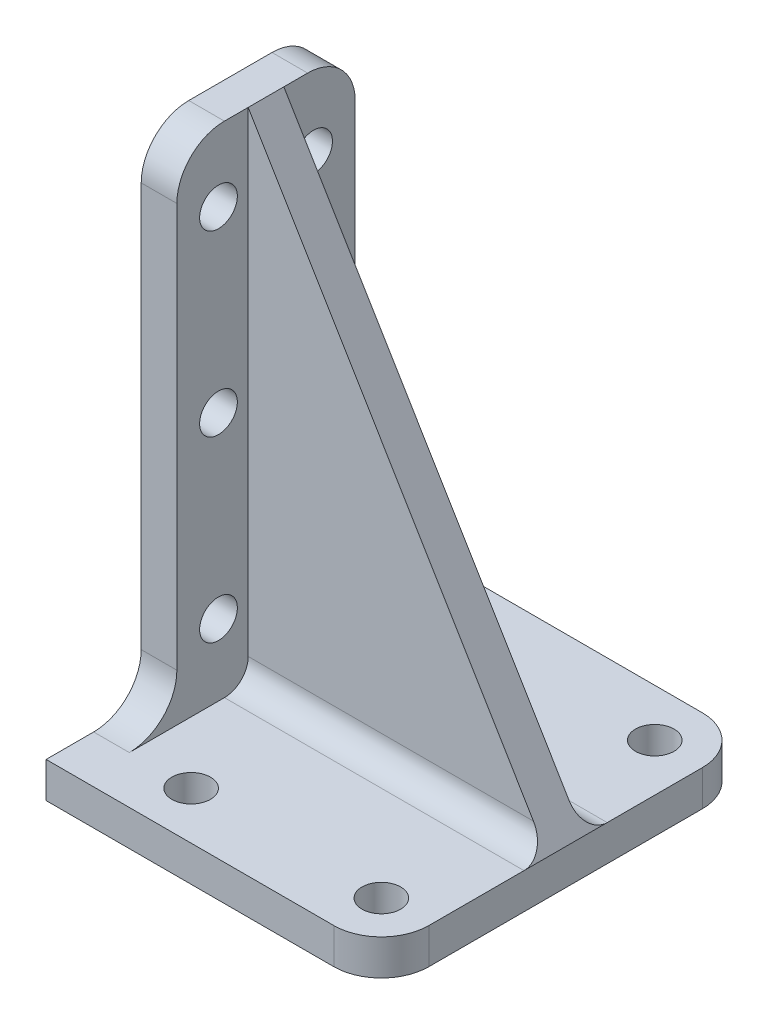
from build123d import *

# Parameters (mm, degrees)
RESSALTO_EXTRUS_O1_DEPTH = 30
ESBO_O2_W                = 12
ESBO_O2_H                = 94
CORTE_EXTRUS_O1_DEPTH    = 118.541482039
ESBO_O3_W                = 30
ESBO_O3_H                = 10
CORTE_EXTRUS_O2_DEPTH    = 118.541482039
ESBO_O4_W                = 3.6
ESBO_O4_H                = 30
CORTE_EXTRUS_O3_DEPTH    = 108.498837203
ESBO_O5_W                = 56.4
ESBO_O5_H                = 6
RESSALTO_EXTRUS_O2_DEPTH = 16
ESBO_O6_W                = 56.4
ESBO_O6_H                = 6
RESSALTO_EXTRUS_O3_DEPTH = 16
FILETE1_R                = 8
FILETE2_R                = 8
FILETE3_R                = 8
FILETE4_R                = 4
ESBO_O7_R                = 3.175
CORTE_EXTRUS_O4_DEPTH    = 113.943171551
ESBO_O8_R                = 3.25
CORTE_EXTRUS_O5_DEPTH    = 112.143870726


with BuildPart() as part:
    # Esboço1 → Ressalto-extrusão1 (new body)
    with BuildSketch(Plane.XY):
        Polygon((0, 0), (0, 100), (60, 0), align=None)
    extrude(amount=RESSALTO_EXTRUS_O1_DEPTH)

    # Esboço2 → Corte-extrusão1 (cut, through all)
    with BuildSketch(Plane.ZY.offset(-6)):
        with Locations((24, 53)):
            Rectangle(ESBO_O2_W, ESBO_O2_H)
        with Locations((6, 53)):
            Rectangle(ESBO_O2_W, ESBO_O2_H)
    extrude(amount=-CORTE_EXTRUS_O1_DEPTH, mode=Mode.SUBTRACT)

    # Esboço3 → Corte-extrusão2 (cut, through all)
    with BuildSketch(Plane(origin=(6, 0, 0), x_dir=(0, 0, -1), z_dir=(1, 0, 0))):
        with Locations((-15, 95)):
            Rectangle(ESBO_O3_W, ESBO_O3_H)
    extrude(amount=-CORTE_EXTRUS_O2_DEPTH, mode=Mode.SUBTRACT)

    # Esboço4 → Corte-extrusão3 (cut, through all)
    with BuildSketch(Plane(origin=(0, 6, 0), x_dir=(1, 0, 0), z_dir=(0, 1, 0))):
        with Locations((58.2, -15)):
            Rectangle(ESBO_O4_W, ESBO_O4_H)
    extrude(amount=-CORTE_EXTRUS_O3_DEPTH, mode=Mode.SUBTRACT)

    # Esboço5 → Ressalto-extrusão2 (add)
    with BuildSketch(Plane.XY.offset(30)):
        with Locations((28.2, 3)):
            Rectangle(ESBO_O5_W, ESBO_O5_H)
    extrude(amount=RESSALTO_EXTRUS_O2_DEPTH)

    # Esboço6 → Ressalto-extrusão3 (add)
    with BuildSketch(Plane(origin=(0, 0, 0), x_dir=(-1, 0, 0), z_dir=(0, 0, -1))):
        with Locations((-28.2, 3)):
            Rectangle(ESBO_O6_W, ESBO_O6_H)
    extrude(amount=RESSALTO_EXTRUS_O3_DEPTH)

    # Filete1
    filete1_edges = [part.edges().sort_by_distance(p)[0] for p in [
        (3, 6, 0),
        (3, 6, 30),
    ]]
    fillet(filete1_edges, radius=FILETE1_R)

    # Filete2
    filete2_edges = [part.edges().sort_by_distance(p)[0] for p in [
        (56.4, 3, -16),
        (56.4, 3, 46),
    ]]
    fillet(filete2_edges, radius=FILETE2_R)

    # Filete3
    filete3_edges = [part.edges().sort_by_distance(p)[0] for p in [
        (3, 90, 30),
        (3, 90, 0),
    ]]
    fillet(filete3_edges, radius=FILETE3_R)

    # Filete4
    filete4_edges = [part.edges().sort_by_distance(p)[0] for p in [
        (31.2, 6, 18),
        (31.2, 6, 12),
    ]]
    fillet(filete4_edges, radius=FILETE4_R)

    # Esboço7 → Corte-extrusão4 (cut, through all)
    with BuildSketch(Plane(origin=(6, 0, 0), x_dir=(0, 0, -1), z_dir=(1, 0, 0))):
        with Locations((-23, 78)):
            Circle(ESBO_O7_R)
        with Locations((-23, 48)):
            Circle(ESBO_O7_R)
        with Locations((-23, 18)):
            Circle(ESBO_O7_R)
        with Locations(Location((-7, 18, 0), (0, 0, 180))):
            Circle(ESBO_O7_R)
        with Locations(Location((-7, 48, 0), (0, 0, 180))):
            Circle(ESBO_O7_R)
        with Locations(Location((-7, 78, 0), (0, 0, 180))):
            Circle(ESBO_O7_R)
    extrude(amount=-CORTE_EXTRUS_O4_DEPTH, mode=Mode.SUBTRACT)

    # Esboço8 → Corte-extrusão5 (cut, through all)
    with BuildSketch(Plane(origin=(0, 6, 0), x_dir=(1, 0, 0), z_dir=(0, 1, 0))):
        with Locations(Location((48.4, 8, 0), (0, 0, 270))):
            Circle(ESBO_O8_R)
        with Locations(Location((48.4, -38, 0), (0, 0, 270))):
            Circle(ESBO_O8_R)
        with Locations(Location((16.4, -38, 0), (0, 0, 270))):
            Circle(ESBO_O8_R)
        with Locations(Location((16.4, 8, 0), (0, 0, 270))):
            Circle(ESBO_O8_R)
    extrude(amount=-CORTE_EXTRUS_O5_DEPTH, mode=Mode.SUBTRACT)


solid = part.part
